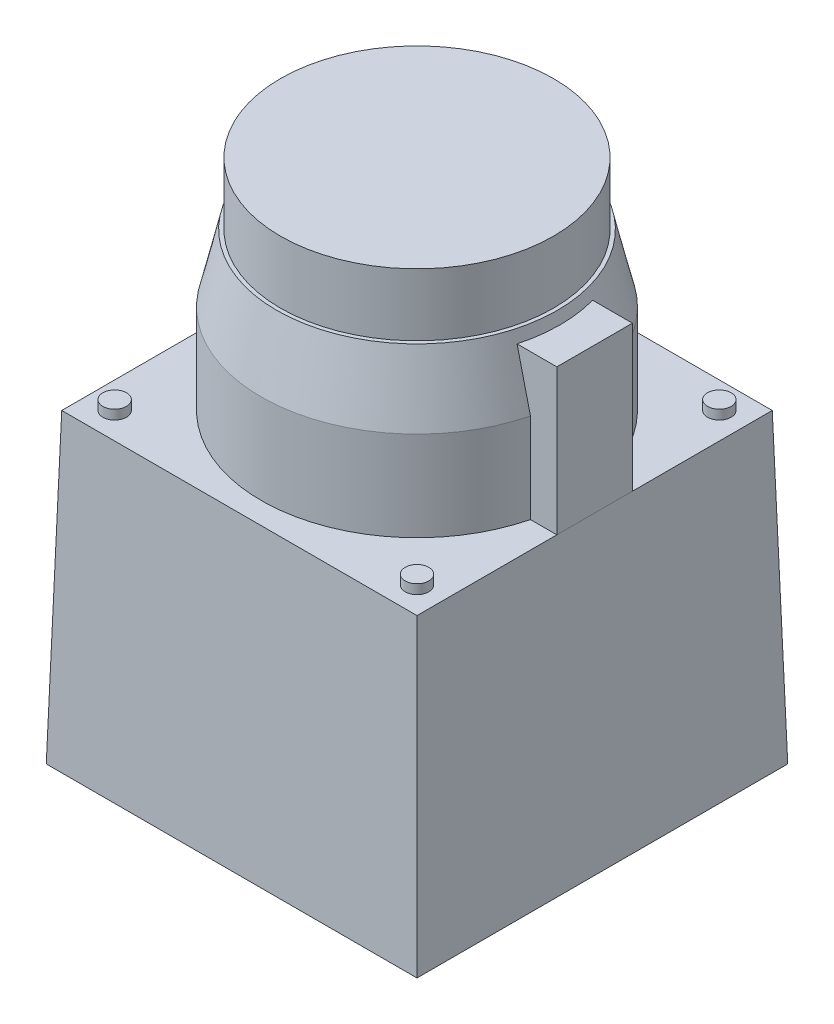
from build123d import *

# Parameters (mm, degrees)
SKETCH4_R           = 20.955
BOSS_EXTRUDE1_DEPTH = 12.065
SKETCH5_R           = 18.8595
SKETCH6_R           = 18.3515
BOSS_EXTRUDE2_DEPTH = 8.382
SKETCH7_R           = 1.5875
BOSS_EXTRUDE3_DEPTH = 1.27
SKETCH8_W           = 7.62
SKETCH8_H           = 10.16
BOSS_EXTRUDE4_DEPTH = 19.558


with BuildPart() as part:
    # Sketch3 → Loft1 section 0
    with BuildSketch(Plane(origin=(0, 41.148, 0), x_dir=(1, 0, 0), z_dir=(0, 1, 0))):
        with BuildLine():
            Line((-23.876, -23.876), (23.876, -23.876))
            Line((23.876, -23.876), (23.876, 23.876))
            Line((23.876, 23.876), (-23.876, 23.876))
            Line((-23.876, 23.876), (-23.876, -23.876))
        make_face()
    # Sketch2 → Loft1 section 1
    with BuildSketch(Plane(origin=(0, 0, 0), x_dir=(1, 0, 0), z_dir=(0, 1, 0))):
        with BuildLine():
            Line((-24.9174, -24.9174), (24.9174, -24.9174))
            Line((24.9174, -24.9174), (24.9174, 24.9174))
            Line((24.9174, 24.9174), (-24.9174, 24.9174))
            Line((-24.9174, 24.9174), (-24.9174, -24.9174))
        make_face()
    loft()

    # Sketch4 → Boss-Extrude1 (add)
    with BuildSketch(Plane(origin=(0, 41.148, 0), x_dir=(1, 0, 0), z_dir=(0, 1, 0))):
        with Locations(Location((0, 0, 0), (0, 0, 90))):
            Circle(SKETCH4_R)
    extrude(amount=BOSS_EXTRUDE1_DEPTH)

    # Sketch5 → section 1 of loft2
    with BuildSketch(Plane(origin=(0, 62.23, 0), x_dir=(1, 0, 0), z_dir=(0, 1, 0)), mode=Mode.PRIVATE) as loft2_s1:
        Circle(SKETCH5_R)
    # loft up to a face of the part (loft2)
    loft([Face(Wire([part.edges().sort_by_distance((-15.275537588, 53.213, 14.344684605))[0]])), loft2_s1.sketch])

    # Sketch6 → Boss-Extrude2 (add)
    with BuildSketch(Plane(origin=(0, 62.23, 0), x_dir=(1, 0, 0), z_dir=(0, 1, 0))):
        with Locations(Location((0, 0, 0), (0, 0, 270))):
            Circle(SKETCH6_R)
    extrude(amount=BOSS_EXTRUDE2_DEPTH)

    # Sketch7 → Boss-Extrude3 (add)
    with BuildSketch(Plane(origin=(0, 41.148, 0), x_dir=(1, 0, 0), z_dir=(0, 1, 0))):
        with Locations(Location((-20.32, 20.32, 0), (0, 0, 90))):
            Circle(SKETCH7_R)
        with Locations(Location((20.32, 20.32, 0), (0, 0, 90))):
            Circle(SKETCH7_R)
        with Locations(Location((-20.32, -20.32, 0), (0, 0, 90))):
            Circle(SKETCH7_R)
        with Locations(Location((20.32, -20.32, 0), (0, 0, 90))):
            Circle(SKETCH7_R)
    extrude(amount=BOSS_EXTRUDE3_DEPTH)

    # Sketch8 → Boss-Extrude4 (add)
    with BuildSketch(Plane(origin=(0, 41.148, 0), x_dir=(1, 0, 0), z_dir=(0, 1, 0))):
        with Locations((20.066, 0)):
            Rectangle(SKETCH8_W, SKETCH8_H)
    extrude(amount=BOSS_EXTRUDE4_DEPTH)


solid = part.part
